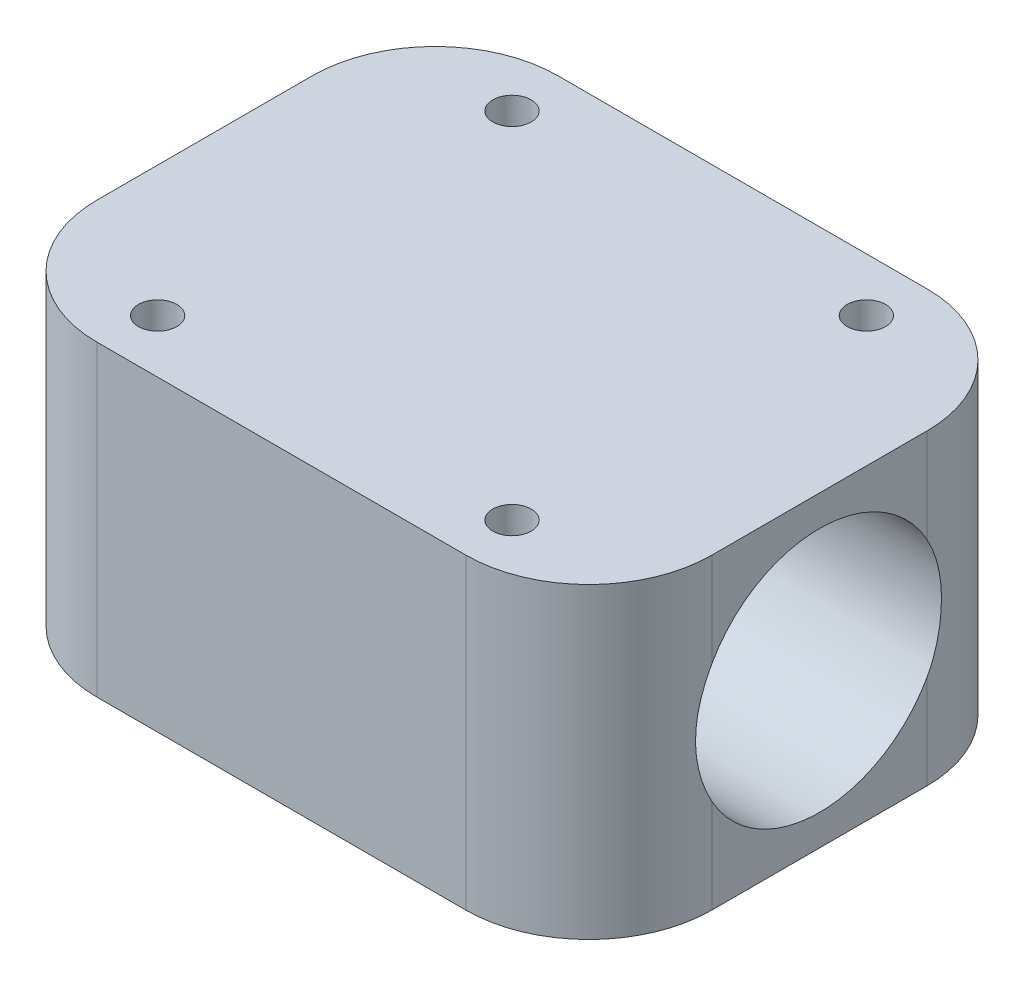
from build123d import *

# Parameters (mm, degrees)
SKETCH_2_R          = 1.25
EXTRUDE_1_DEPTH     = 20
SKETCH_3_R          = 8
CUT_EXTRUDE_1_DEPTH = 48.16990566


with BuildPart() as part:
    # 草圖2 → 填料-伸長1 (new body)
    with BuildSketch(Plane(origin=(0, 0, 0), x_dir=(1, 0, 0), z_dir=(0, 1, 0))):
        with BuildLine():
            Line((-12, 15), (12, 15))
            ThreePointArc((12, 15), (17.656854249, 12.656854249), (20, 7))
            Line((20, 7), (20, -7))
            ThreePointArc((20, -7), (17.656854249, -12.656854249), (12, -15))
            Line((12, -15), (-12, -15))
            ThreePointArc((-12, -15), (-17.656854249, -12.656854249), (-20, -7))
            Line((-20, -7), (-20, 7))
            ThreePointArc((-20, 7), (-17.656854249, 12.656854249), (-12, 15))
        make_face()
        with Locations(Location((-11.525840533, 11.525840533, 0), (0, 0, 270))):
            Circle(SKETCH_2_R, mode=Mode.SUBTRACT)
        with Locations(Location((11.525840533, 11.525840533, 0), (0, 0, 270))):
            Circle(SKETCH_2_R, mode=Mode.SUBTRACT)
        with Locations(Location((11.525840533, -11.525840533, 0), (0, 0, 270))):
            Circle(SKETCH_2_R, mode=Mode.SUBTRACT)
        with Locations(Location((-11.525840533, -11.525840533, 0), (0, 0, 270))):
            Circle(SKETCH_2_R, mode=Mode.SUBTRACT)
    extrude(amount=EXTRUDE_1_DEPTH)

    # 草圖3 → 除料-伸長1 (cut, through all)
    with BuildSketch(Plane(origin=(20, 0, 0), x_dir=(0, 0, -1), z_dir=(1, 0, 0))):
        with Locations(Location((0, 10, 0), (0, 0, 331.044975628))):
            Circle(SKETCH_3_R)
    extrude(amount=-CUT_EXTRUDE_1_DEPTH, mode=Mode.SUBTRACT)


solid = part.part
